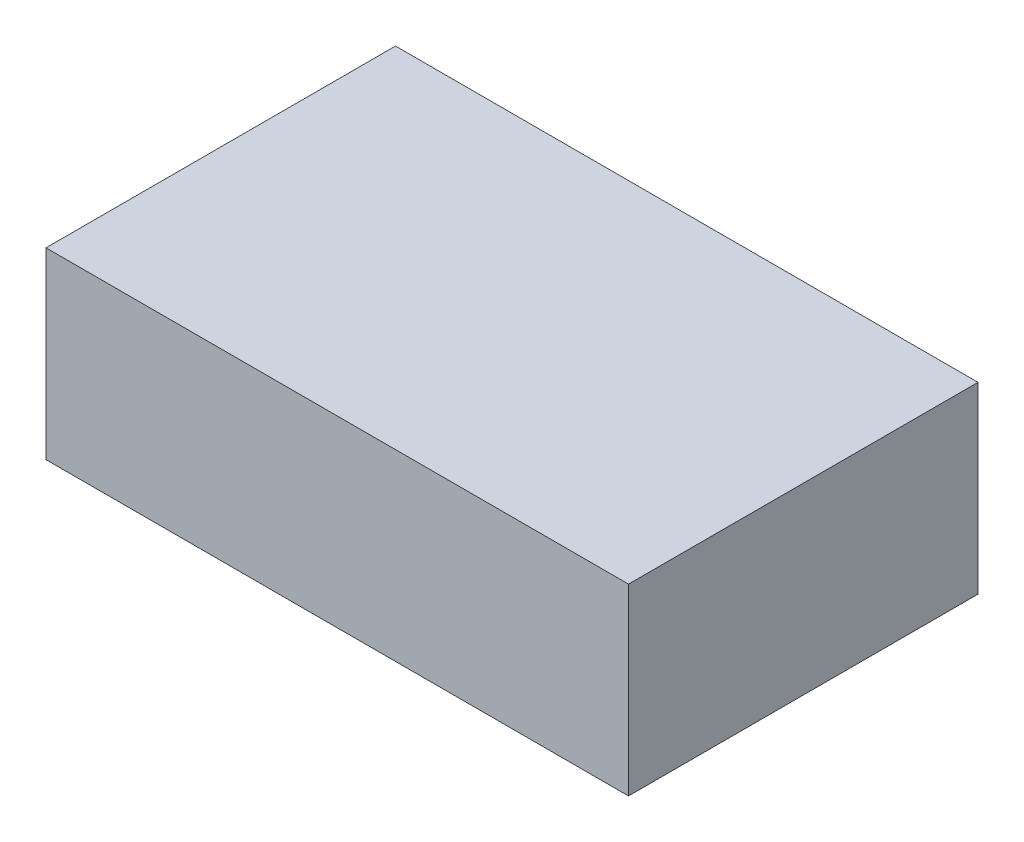
from build123d import *

# Parameters (mm, degrees)
SKETCH1_W           = 38.1
SKETCH1_H           = 22.86
BOSS_EXTRUDE1_DEPTH = 12


with BuildPart() as part:
    # Sketch1 → Boss-Extrude1 (new body)
    with BuildSketch(Plane(origin=(0, 0, 0), x_dir=(1, 0, 0), z_dir=(0, 1, 0))):
        with Locations((19.05, 11.43)):
            Rectangle(SKETCH1_W, SKETCH1_H)
    extrude(amount=BOSS_EXTRUDE1_DEPTH)


solid = part.part
